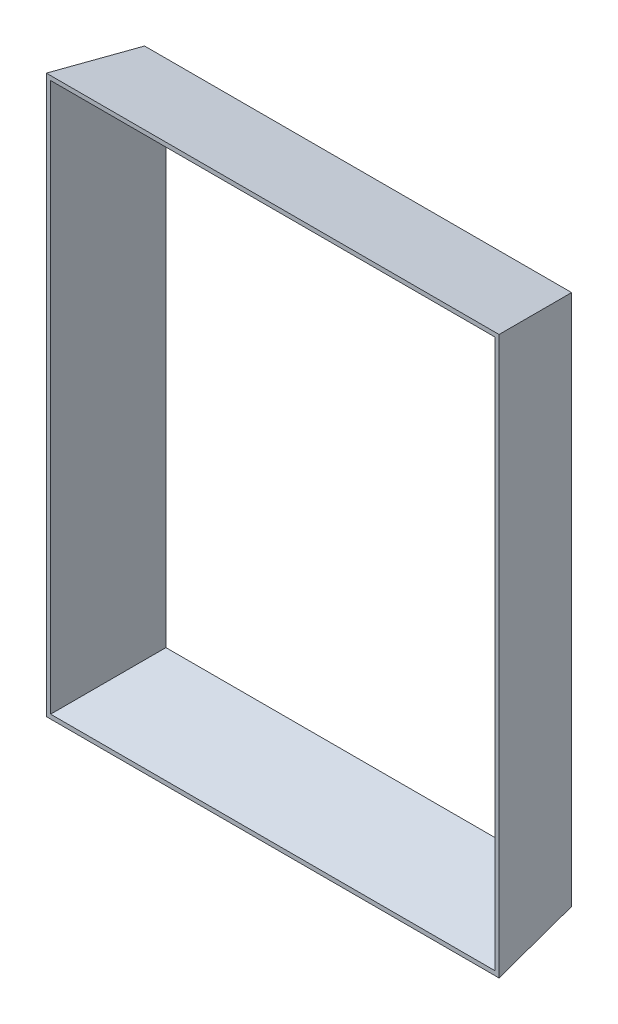
from build123d import *


with BuildPart() as part:
    # Sketch9 → Loft1 section 0
    with BuildSketch(Plane.XY.offset(200)):
        with BuildLine():
            Line((-224.025723473, -663.072347267), (-224.025723473, 641.927652733))
            Line((-224.025723473, 641.927652733), (-1284.025723473, 641.927652733))
            Line((-1284.025723473, 641.927652733), (-1284.025723473, -663.072347267))
            Line((-1284.025723473, -663.072347267), (-224.025723473, -663.072347267))
        make_face()
    # Sketch1 → Loft1 section 1
    with BuildSketch(Plane.XY):
        with BuildLine():
            Line((-1254.025723473, 611.927652733), (-254.025723473, 611.927652733))
            Line((-254.025723473, 611.927652733), (-254.025723473, -633.072347267))
            Line((-254.025723473, -633.072347267), (-1254.025723473, -633.072347267))
            Line((-1254.025723473, -633.072347267), (-1254.025723473, 611.927652733))
        make_face()
    loft()

    # Sketch13 → Cut-Loft5 section 0
    with BuildSketch(Plane.XY):
        with BuildLine():
            Line((-1204.025723473, -583.072347267), (-304.025723473, -583.072347267))
            Line((-304.025723473, -583.072347267), (-304.025723473, 561.927652733))
            Line((-304.025723473, 561.927652733), (-1204.025723473, 561.927652733))
            Line((-1204.025723473, 561.927652733), (-1204.025723473, -583.072347267))
        make_face()
    # Sketch12 → Cut-Loft5 section 1
    with BuildSketch(Plane.XY.offset(200)):
        with BuildLine():
            Line((-1274.025723473, 631.927652733), (-1274.025723473, -653.072347267))
            Line((-1274.025723473, -653.072347267), (-234.025723473, -653.072347267))
            Line((-234.025723473, -653.072347267), (-234.025723473, 631.927652733))
            Line((-234.025723473, 631.927652733), (-1274.025723473, 631.927652733))
        make_face()
    loft(mode=Mode.SUBTRACT)


solid = part.part
